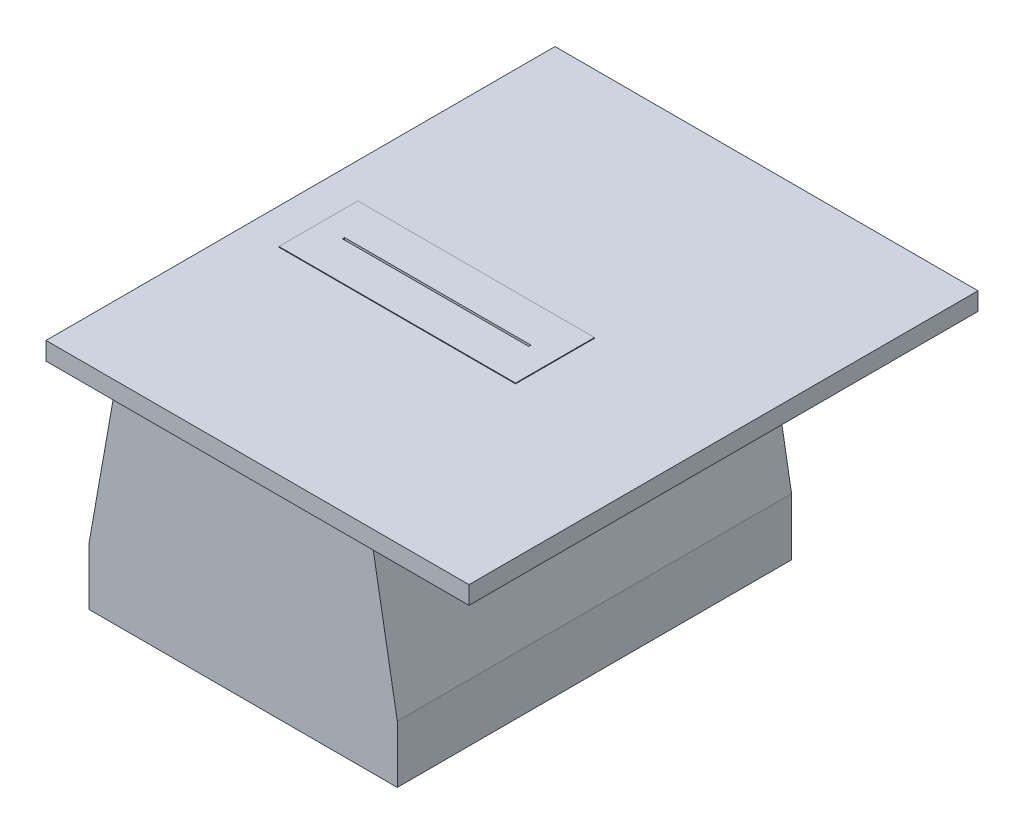
from build123d import *

# Parameters (mm, degrees)
BOSS_EXTRU_1_DEPTH      = 550
ESQUISSE2_W             = 590
ESQUISSE2_H             = 710
BOSS_EXTRU_2_DEPTH      = 25
ESQUISSE3_W             = 330
ESQUISSE3_H             = 110
BOSS_EXTRU_3_DEPTH      = 1
ESQUISSE4_W             = 260
ESQUISSE4_H             = 3
ENL_V_MAT_EXTRU_1_DEPTH = 3


with BuildPart() as part:
    # Esquisse1 → Boss.-Extru.1 (new body)
    with BuildSketch(Plane.XY):
        Polygon((-215, 0), (215, 0), (215, 80), (176.208064244, 300), (-176.208064244, 300), (-215, 80), align=None)
    extrude(amount=BOSS_EXTRU_1_DEPTH)

    # Esquisse2 → Boss.-Extru.2 (add)
    with BuildSketch(Plane(origin=(0, 300, 0), x_dir=(1, 0, 0), z_dir=(0, 1, 0))):
        with Locations((50, -225)):
            Rectangle(ESQUISSE2_W, ESQUISSE2_H)
    extrude(amount=BOSS_EXTRU_2_DEPTH)

    # Esquisse3 → Boss.-Extru.3 (add)
    with BuildSketch(Plane(origin=(0, 325, 0), x_dir=(1, 0, 0), z_dir=(0, 1, 0))):
        with Locations((-30, -250)):
            Rectangle(ESQUISSE3_W, ESQUISSE3_H)
    extrude(amount=BOSS_EXTRU_3_DEPTH)

    # Esquisse4 → Enlèv. mat.-Extru.1 (cut)
    with BuildSketch(Plane(origin=(0, 326, 0), x_dir=(1, 0, 0), z_dir=(0, 1, 0))):
        with Locations((-30, -250)):
            Rectangle(ESQUISSE4_W, ESQUISSE4_H)
    extrude(amount=-ENL_V_MAT_EXTRU_1_DEPTH, mode=Mode.SUBTRACT)


solid = part.part
